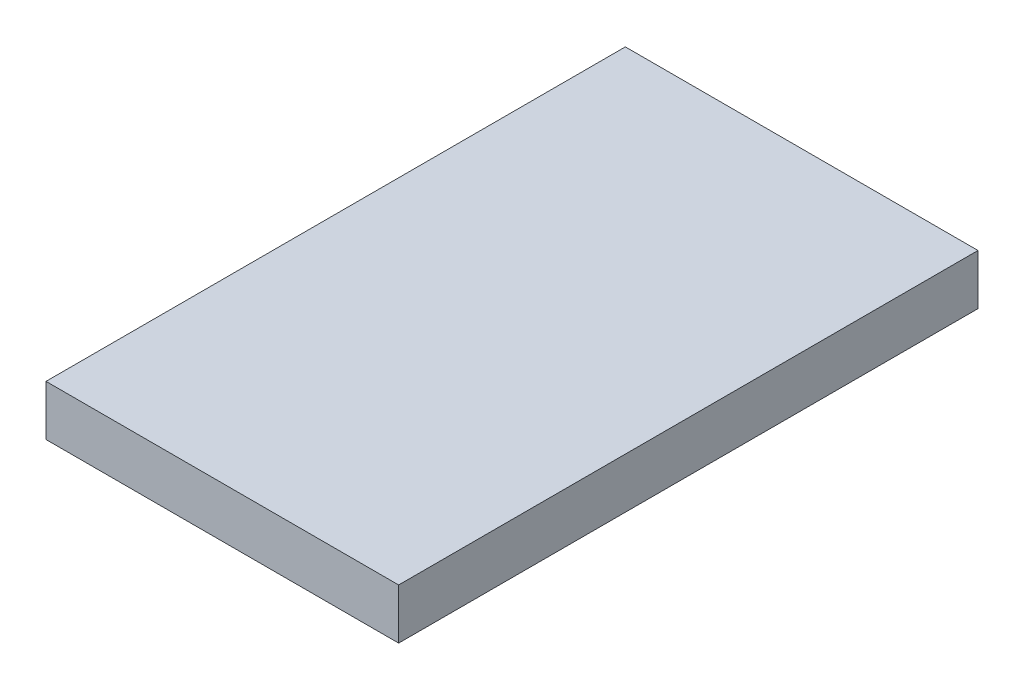
from build123d import *

# Parameters (mm, degrees)
SKETCH1_W           = 14
SKETCH1_H           = 23
BOSS_EXTRUDE1_DEPTH = 2


with BuildPart() as part:
    # Sketch1 → Boss-Extrude1 (new body)
    with BuildSketch(Plane(origin=(0, 0, 0), x_dir=(1, 0, 0), z_dir=(0, 1, 0))):
        with Locations((7, 11.5)):
            Rectangle(SKETCH1_W, SKETCH1_H)
    extrude(amount=BOSS_EXTRUDE1_DEPTH)


solid = part.part
